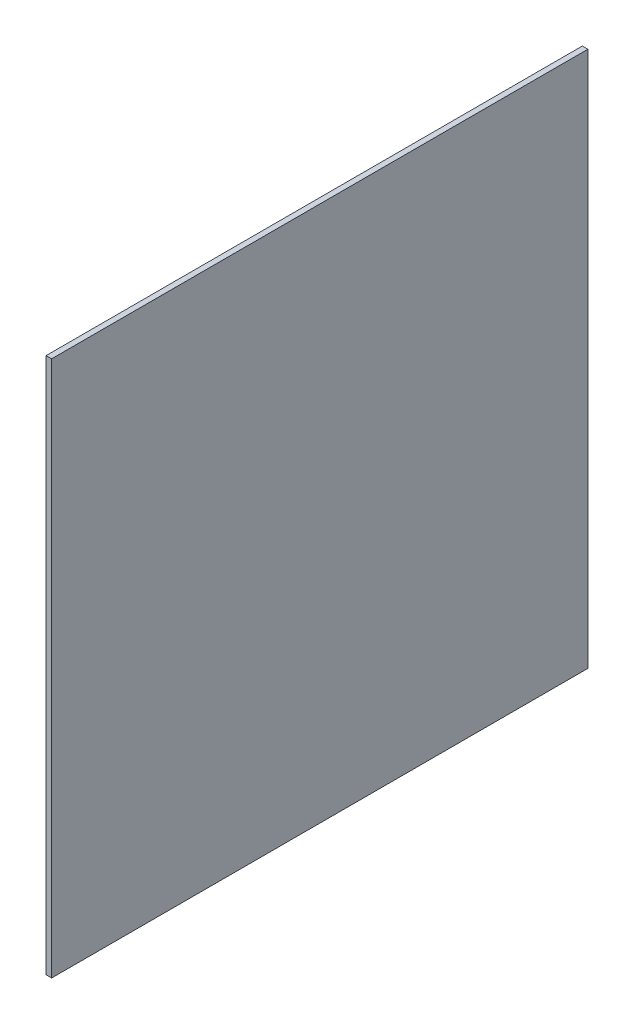
from build123d import *

# Parameters (mm, degrees)
SKETCH_2_W      = 290
SKETCH_2_H      = 290
EXTRUDE_1_DEPTH = 3


with BuildPart() as part:
    # 草图2 → 凸台-拉伸1 (new body)
    with BuildSketch(Plane(origin=(0, 0, 0), x_dir=(0, 0, -1), z_dir=(1, 0, 0))):
        with Locations((86.934771341, -94.313678499)):
            Rectangle(SKETCH_2_W, SKETCH_2_H)
    extrude(amount=EXTRUDE_1_DEPTH)


solid = part.part
